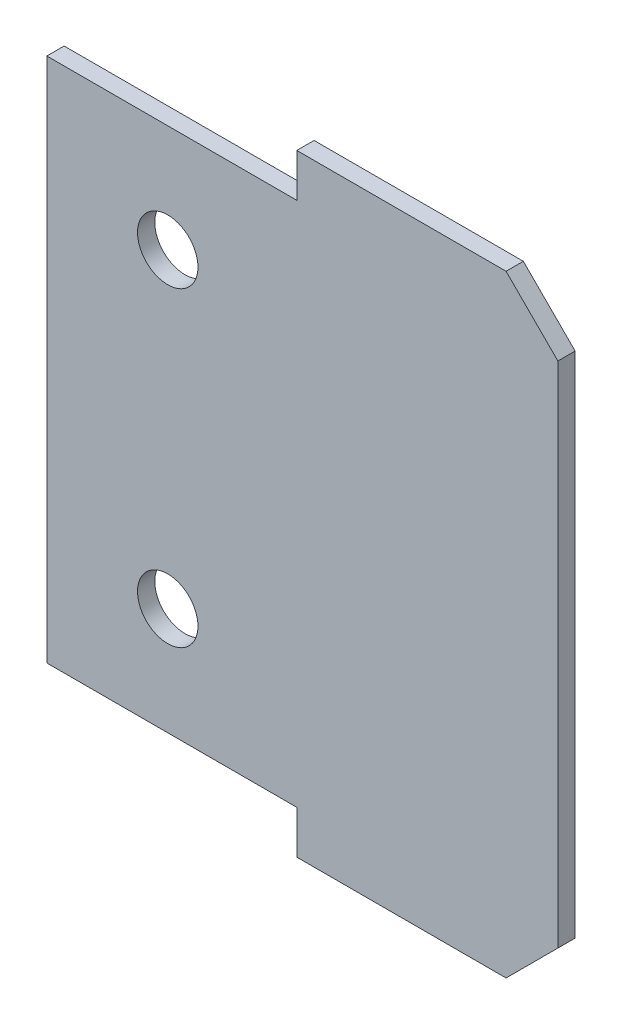
from build123d import *

# Parameters (mm, degrees)
SKETCH1_R           = 11.1125
BOSS_EXTRUDE1_DEPTH = 6.35


with BuildPart() as part:
    # Sketch1 → Boss-Extrude1 (new body)
    with BuildSketch(Plane.XY):
        Polygon((981.209753019, 235.740604852), (981.209753019, 42.446604852), (1073.10836413, 42.446604852), (1073.10836413, 26.571604852), (1150.056253019, 26.571604852), (1169.106253019, 45.621604852), (1169.106253019, 232.565604852), (1150.056253019, 251.615604852), (1073.10836413, 251.615604852), (1073.10836413, 235.740604852), align=None)
        with Locations((1025.659753019, 196.243604852)):
            Circle(SKETCH1_R, mode=Mode.SUBTRACT)
        with Locations((1025.659753019, 81.943604852)):
            Circle(SKETCH1_R, mode=Mode.SUBTRACT)
    extrude(amount=BOSS_EXTRUDE1_DEPTH)


solid = part.part
